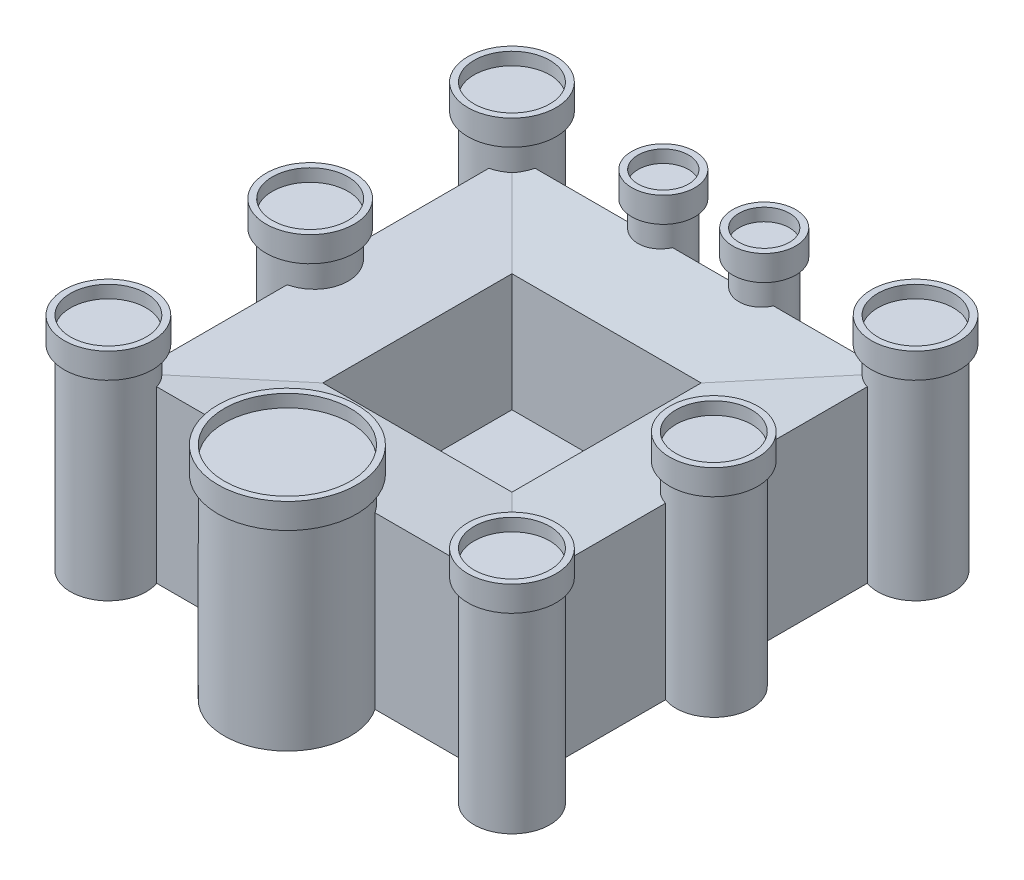
from build123d import *
from build123d.topology import SkipClean

# Parameters (mm, degrees)
CROQUIS1_W              = 30
CROQUIS1_H              = 30
SALIENTE_EXTRUIR1_DEPTH = 10
CROQUIS2_W              = 15
CROQUIS2_H              = 15
CORTAR_EXTRUIR2_DEPTH   = 10
CROQUIS3_W              = 30
CROQUIS3_H              = 30
CORTAR_EXTRUIR3_DEPTH   = 1
CORTAR_EXTRUIR3_DRAFT   = -85
CROQUIS4_R              = 3
CROQUIS4_R_2            = 2
SALIENTE_EXTRUIR3_DEPTH = 12
CROQUIS5_R              = 3.5
CROQUIS5_R_2            = 2.5
SALIENTE_EXTRUIR4_DEPTH = 2
CORTAR_EXTRUIR4_START   = -1
CROQUIS6_R              = 3
CROQUIS6_R_2            = 2
CORTAR_EXTRUIR4_DEPTH   = 1
CORTAR_EXTRUIR5_DEPTH   = 1
SALIENTE_EXTRUIR5_START = 3.5
SALIENTE_EXTRUIR5_DEPTH = 3.5
SALIENTE_EXTRUIR6_REACH = 32.927
CROQUIS9_R              = 5
CROQUIS10_R             = 5.5
SALIENTE_EXTRUIR7_DEPTH = 2
CORTAR_EXTRUIR7_START   = -1
CROQUIS11_R             = 5
CORTAR_EXTRUIR7_DEPTH   = 1
SALIENTE_EXTRUIR8_START = 3.5
SALIENTE_EXTRUIR8_DEPTH = 3.5
CROQUIS13_R             = 1.6
CORTAR_EXTRUIR8_DEPTH   = 3


with BuildPart() as part:
    # Croquis1 → Saliente-Extruir1 (new body)
    with BuildSketch(Plane(origin=(0, 0, 0), x_dir=(1, 0, 0), z_dir=(0, 1, 0))):
        Rectangle(CROQUIS1_W, CROQUIS1_H)
    extrude(amount=SALIENTE_EXTRUIR1_DEPTH)

    # Croquis2 → Cortar-Extruir2 (cut)
    with BuildSketch(Plane(origin=(0, 10, 0), x_dir=(1, 0, 0), z_dir=(0, 1, 0))):
        Rectangle(CROQUIS2_W, CROQUIS2_H)
    extrude(amount=-CORTAR_EXTRUIR2_DEPTH, mode=Mode.SUBTRACT)


with BuildPart() as cortar_extruir3_tool:
    # Croquis3 → Cortar-Extruir3 (with draft: the straight prism first)
    with BuildSketch(Plane(origin=(0, 10, 0), x_dir=(1, 0, 0), z_dir=(0, 1, 0))):
        Rectangle(CROQUIS3_W, CROQUIS3_H)
    extrude(amount=-CORTAR_EXTRUIR3_DEPTH)
    # Cortar-Extruir3: the draft: its side faces are tilted about the plane it starts from
    cortar_extruir3_sides = [cortar_extruir3_tool.faces().sort_by_distance(p)[0] for p in [
        (15, 9.5, 0),
        (0, 9.5, -15),
        (-15, 9.5, 0),
        (0, 9.5, 15),
    ]]
    draft(cortar_extruir3_sides, Plane(origin=(0, 10, 0), x_dir=(1, 0, 0), z_dir=(0, 1, 0)), CORTAR_EXTRUIR3_DRAFT)


with BuildPart() as part_1:
    add(part.part)

    # Cortar-Extruir3: cut by cortar_extruir3_tool
    add(cortar_extruir3_tool.part, mode=Mode.SUBTRACT)

    # Croquis4 → Saliente-Extruir3 (add)
    with BuildSketch(Plane(origin=(0, 0, 0), x_dir=(1, 0, 0), z_dir=(0, 1, 0))):
        with Locations(Location((-16, 16, 0), (0, 0, 340.528779366))):
            Circle(CROQUIS4_R)
        with Locations(Location((16, 16, 0), (0, 0, 199.471220634))):
            Circle(CROQUIS4_R)
        with Locations(Location((16, 0, 0), (0, 0, 109.471220634))):
            Circle(CROQUIS4_R)
        with Locations(Location((16, -16, 0), (0, 0, 109.471220634))):
            Circle(CROQUIS4_R)
        with Locations(Location((-16, 0, 0), (0, 0, 70.528779366))):
            Circle(CROQUIS4_R)
        with Locations(Location((-16, -16, 0), (0, 0, 70.528779366))):
            Circle(CROQUIS4_R)
        with Locations(Location((-4, 16, 0), (0, 0, 330))):
            Circle(CROQUIS4_R_2)
        with Locations(Location((4, 16, 0), (0, 0, 330))):
            Circle(CROQUIS4_R_2)
    extrude(amount=SALIENTE_EXTRUIR3_DEPTH)

    # Croquis5 → Saliente-Extruir4 (add)
    with BuildSketch(Plane(origin=(0, 12, 0), x_dir=(1, 0, 0), z_dir=(0, 1, 0))):
        with Locations(Location((-16, 16, 0), (0, 0, 270))):
            Circle(CROQUIS5_R)
        with Locations(Location((-4, 16, 0), (0, 0, 270))):
            Circle(CROQUIS5_R_2)
        with Locations(Location((4, 16, 0), (0, 0, 270))):
            Circle(CROQUIS5_R_2)
        with Locations(Location((16, 16, 0), (0, 0, 270))):
            Circle(CROQUIS5_R)
        with Locations(Location((-16, 0, 0), (0, 0, 270))):
            Circle(CROQUIS5_R)
        with Locations(Location((16, 0, 0), (0, 0, 270))):
            Circle(CROQUIS5_R)
        with Locations(Location((16, -16, 0), (0, 0, 270))):
            Circle(CROQUIS5_R)
        with Locations(Location((-16, -16, 0), (0, 0, 270))):
            Circle(CROQUIS5_R)
    extrude(amount=SALIENTE_EXTRUIR4_DEPTH)

    # Croquis6 → Cortar-Extruir4 (cut)
    with BuildSketch(Plane(origin=(0, 14, 0), x_dir=(1, 0, 0), z_dir=(0, 1, 0)).offset(CORTAR_EXTRUIR4_START)):
        with Locations(Location((-16, -16, 0), (0, 0, 70.528779366))):
            Circle(CROQUIS6_R)
        with Locations(Location((-16, 0, 0), (0, 0, 70.528779366))):
            Circle(CROQUIS6_R)
        with Locations(Location((-16, 16, 0), (0, 0, 340.528779366))):
            Circle(CROQUIS6_R)
        with Locations(Location((-4, 16, 0), (0, 0, 330))):
            Circle(CROQUIS6_R_2)
        with Locations(Location((4, 16, 0), (0, 0, 330))):
            Circle(CROQUIS6_R_2)
        with Locations(Location((16, 16, 0), (0, 0, 199.471220634))):
            Circle(CROQUIS6_R)
        with Locations(Location((16, 0, 0), (0, 0, 109.471220634))):
            Circle(CROQUIS6_R)
        with Locations(Location((16, -16, 0), (0, 0, 109.471220634))):
            Circle(CROQUIS6_R)
    extrude(amount=CORTAR_EXTRUIR4_DEPTH, mode=Mode.SUBTRACT)

    # Croquis7 → Cortar-Extruir5 (cut)
    with BuildSketch(Plane(origin=(0, 0, -15), x_dir=(-1, 0, 0), z_dir=(0, 0, -1))):
        with BuildLine():
            Line((-1.5, 0), (-1.5, 2))
            add(Edge.make_bspline(
                [(-1.5, 2), (-1.5, 3.25), (0, 5.335598169)],
                knots=[0, 0, 0, 1, 1, 1], degree=2))
            add(Edge.make_bspline(
                [(1.5, 2), (1.5, 3.25), (0, 5.335598169)],
                knots=[0, 0, 0, 1, 1, 1], degree=2))
            Line((1.5, 2), (1.5, 0))
            Line((1.5, 0), (-1.5, 0))
        make_face()
    extrude(amount=-CORTAR_EXTRUIR5_DEPTH, mode=Mode.SUBTRACT)

    # Croquis8 → Saliente-Extruir5 (add)
    with SkipClean():  # the faces are left unmerged after this step: merging them gives an invalid solid
        with BuildSketch(Plane.XZ.offset(SALIENTE_EXTRUIR5_START)):
            with BuildLine():
                Line((-1.5, -15), (-1.5, -14))
                Line((-1.5, -14), (1.5, -14))
                Line((1.5, -14), (1.5, -15))
                Line((1.5, -15), (2.267949192, -15))
                ThreePointArc((2.267949192, -15), (4, -18), (5.732050808, -15))
                Line((5.732050808, -15), (13.171572875, -15))
                ThreePointArc((13.171572875, -15), (18.121320344, -18.121320344), (15, -13.171572875))
                Line((15, -13.171572875), (15, -2.828427125))
                ThreePointArc((15, -2.828427125), (19, 0), (15, 2.828427125))
                Line((15, 2.828427125), (15, 13.171572875))
                ThreePointArc((15, 13.171572875), (18.121320344, 18.121320344), (13.171572875, 15))
                Line((13.171572875, 15), (-13.171572875, 15))
                ThreePointArc((-13.171572875, 15), (-18.121320344, 18.121320344), (-15, 13.171572875))
                Line((-15, 13.171572875), (-15, 2.828427125))
                ThreePointArc((-15, 2.828427125), (-19, 0), (-15, -2.828427125))
                Line((-15, -2.828427125), (-15, -13.171572875))
                ThreePointArc((-15, -13.171572875), (-18.121320344, -18.121320344), (-13.171572875, -15))
                Line((-13.171572875, -15), (-5.732050808, -15))
                ThreePointArc((-5.732050808, -15), (-4, -18), (-2.267949192, -15))
                Line((-2.267949192, -15), (-1.5, -15))
            make_face()
        extrude(amount=-SALIENTE_EXTRUIR5_DEPTH)

    # Saliente-Extruir6: up to this face of the body (flat: up to its plane)
    saliente_extruir6_end = Plane(part_1.part.faces().sort_by_distance((-16, 12, 12.598994949))[0])
    # Croquis9 → Saliente-Extruir6 (add, up to the picked face)
    with BuildSketch(Plane(origin=(0, 0, 0), x_dir=(1, 0, 0), z_dir=(0, 1, 0)), mode=Mode.PRIVATE) as saliente_extruir6_sk1:
        with Locations(Location((0, -17.806013585, 0), (0, 0, 34.139014511))):
            Circle(CROQUIS9_R)
    saliente_extruir6_tool1 = split(extrude(saliente_extruir6_sk1.sketch, amount=SALIENTE_EXTRUIR6_REACH, mode=Mode.PRIVATE), bisect_by=saliente_extruir6_end, keep=Keep.BOTH, mode=Mode.PRIVATE)
    add(saliente_extruir6_tool1.solids().sort_by(Axis((0, 0, 17.806014), (0, 1, 0)))[0])

    # Croquis10 → Saliente-Extruir7 (add)
    with SkipClean():  # the faces are left unmerged after this step: merging them gives an invalid solid
        with BuildSketch(Plane(origin=(0, 12, 0), x_dir=(1, 0, 0), z_dir=(0, 1, 0))):
            with Locations(Location((0, -17.806013585, 0), (0, 0, 270))):
                Circle(CROQUIS10_R)
        extrude(amount=SALIENTE_EXTRUIR7_DEPTH)

    # Croquis11 → Cortar-Extruir7 (cut)
    with SkipClean():  # the faces are left unmerged after this step: merging them gives an invalid solid
        with BuildSketch(Plane(origin=(0, 14, 0), x_dir=(1, 0, 0), z_dir=(0, 1, 0)).offset(CORTAR_EXTRUIR7_START)):
            with Locations(Location((0, -17.806013585, 0), (0, 0, 34.139014511))):
                Circle(CROQUIS11_R)
        extrude(amount=CORTAR_EXTRUIR7_DEPTH, mode=Mode.SUBTRACT)

    # Croquis12 → Saliente-Extruir8 (add)
    with SkipClean():  # the faces are left unmerged after this step: merging them gives an invalid solid
        with BuildSketch(Plane.XZ.offset(SALIENTE_EXTRUIR8_START)):
            with BuildLine():
                Line((-4.138391929, 15), (4.138391929, 15))
                ThreePointArc((4.138391929, 15), (0, 22.806013585), (-4.138391929, 15))
            make_face()
        extrude(amount=-SALIENTE_EXTRUIR8_DEPTH)

    # Croquis13 → Cortar-Extruir8 (cut)
    with SkipClean():  # the faces are left unmerged after this step: merging them gives an invalid solid
        with BuildSketch(Plane.XZ.offset(3.5)):
            with Locations(Location((0, 0, 0), (0, 0, 270))):
                Circle(CROQUIS13_R)
        extrude(amount=-CORTAR_EXTRUIR8_DEPTH, mode=Mode.SUBTRACT)


solid = part_1.part
